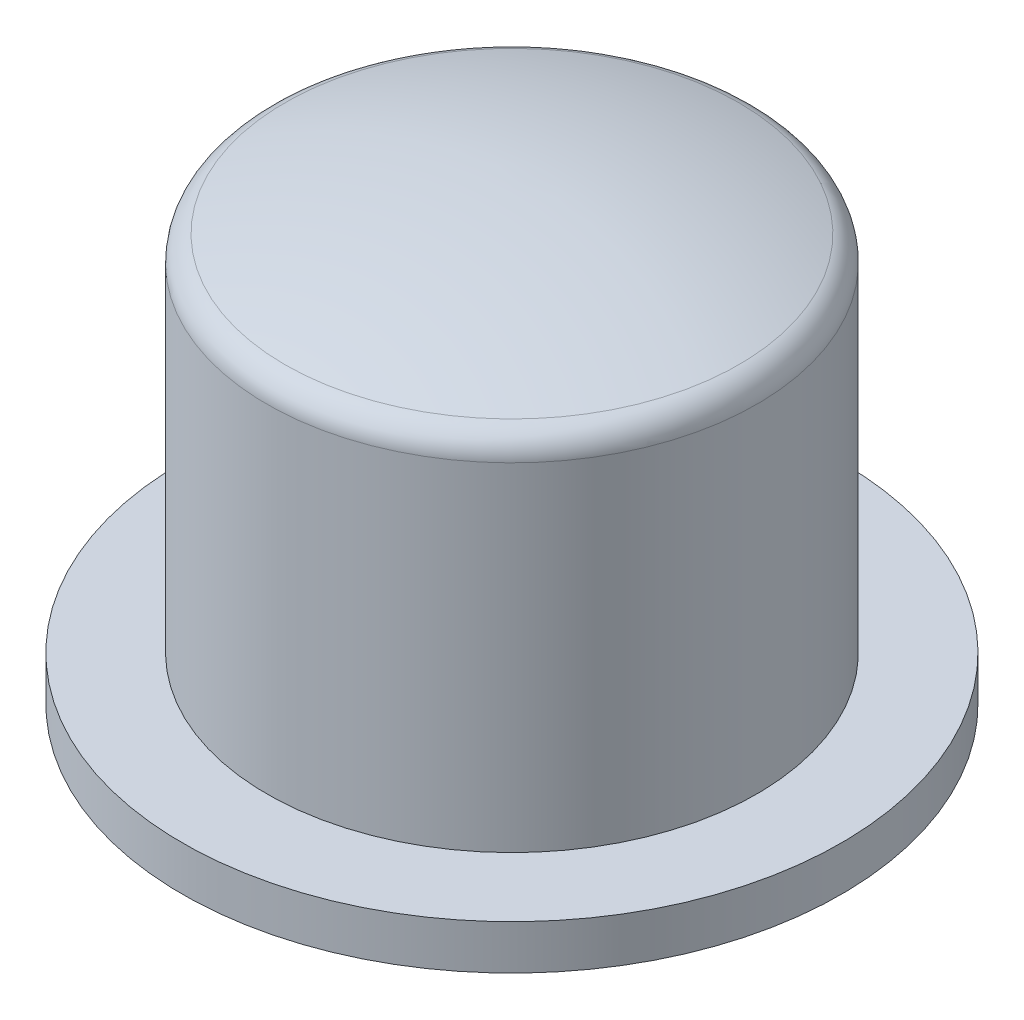
from build123d import *

# Parameters (mm, degrees)
DOME_2_FACE_RADIUS = 2.75
DOME_2_HEIGHT      = 0.5
FILLET_1_R         = 0.3


with BuildPart() as part:
    # 草图1 → 旋转2 (revolve)
    with BuildSketch(Plane.XY, mode=Mode.PRIVATE) as revolve_2_sk:
        Polygon((-3.7, 0), (-1.6, 0), (-1.6, 3.5), (0, 3.5), (0, 4.5), (-2.75, 4.5), (-2.75, 0.5), (-3.7, 0.5), align=None)
    revolve(revolve_2_sk.sketch.rotate(Axis((0, -1.216580074, 0), (0, 1, 0)), 270), axis=Axis((0, -1.216580074, 0), (0, 1, 0)))

    # 圆顶2: a dome of height H over a round flat face of radius A is a cap of a sphere of radius (A * A + H * H) / (2 * H)
    dome_2_r = (DOME_2_FACE_RADIUS * DOME_2_FACE_RADIUS + DOME_2_HEIGHT * DOME_2_HEIGHT) / (2 * DOME_2_HEIGHT)
    dome_2_base = Plane((0, 4.5, 0), z_dir=(0, 1, 0))
    with Locations(dome_2_base.offset(DOME_2_HEIGHT - dome_2_r)):
        dome_2_ball = Sphere(dome_2_r, mode=Mode.PRIVATE)
    add(split(dome_2_ball, bisect_by=dome_2_base, keep=Keep.TOP, mode=Mode.PRIVATE))

    # 圆角1
    fillet_1_edges = [part.edges().sort_by_distance(p)[0] for p in [
        (2.75, 4.5, 0),
    ]]
    fillet(fillet_1_edges, radius=FILLET_1_R)


solid = part.part
